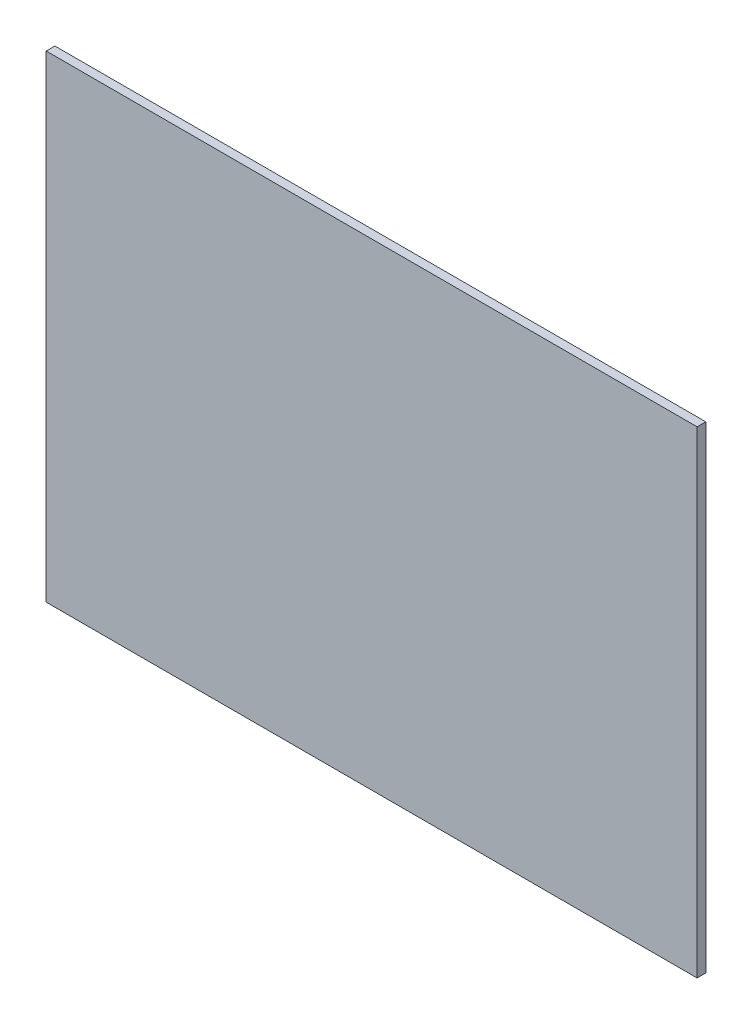
from build123d import *

# Parameters (mm, degrees)
SKETCH1_W           = 381
SKETCH1_H           = 279.4
BOSS_EXTRUDE1_DEPTH = 5.08


with BuildPart() as part:
    # Sketch1 → Boss-Extrude1 (new body)
    with BuildSketch(Plane.XY):
        with Locations((190.5, 139.7)):
            Rectangle(SKETCH1_W, SKETCH1_H)
    extrude(amount=BOSS_EXTRUDE1_DEPTH)


solid = part.part
